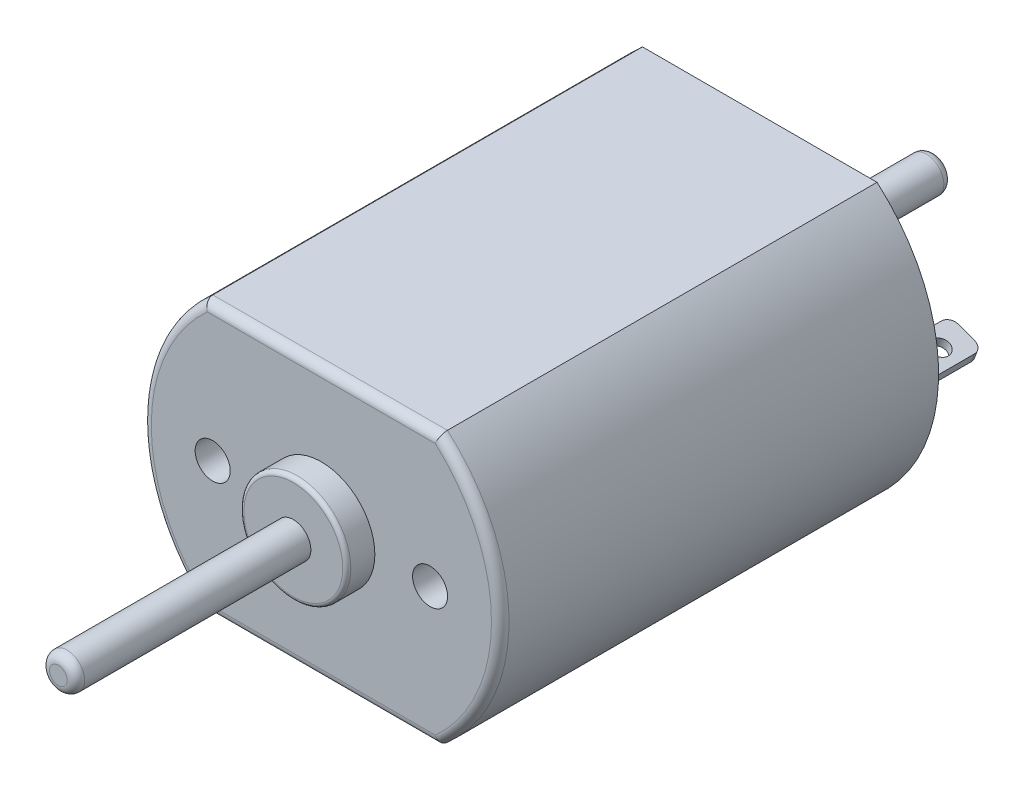
from build123d import *

# Parameters (mm, degrees)
BOSS_EXTRUDE1_DEPTH          = 25
FILLET1_R                    = 0.5
SKETCH2_R                    = 3.05
BOSS_EXTRUDE2_DEPTH          = 1.6
SKETCH3_R                    = 1
BOSS_EXTRUDE3_DEPTH          = 13.4
SKETCH4_R                    = 3.075
BOSS_EXTRUDE4_DEPTH          = 2
FILLET2_R                    = 0.23
BOSS_EXTRUDE6_START          = 8
SKETCH5_R                    = 1
BOSS_EXTRUDE6_DEPTH          = 8
FILLET3_R                    = 0.5
BOSS_EXTRUDE7_DEPTH          = 4.3
SKETCH6_3_R                  = 1.1999999999999995
SKETCH6_3_R_2                = 1.2000000000000004
BOSS_EXTRUDE8_DEPTH          = 0.3
FILLET4_R                    = 0.5
CUT_EXTRUDE1_DEPTH           = 43.18502328832356
CUT_EXTRUDE1_DEPTH_BACK      = 43.18502328832356
SKETCH7_R                    = 0.4999999999999999
SKETCH7_R_2                  = 0.5000000000000017
F_2_0_2_DIAMETER_HOLE1_D     = 2
F_2_0_2_DIAMETER_HOLE1_DEPTH = 2
F_2_0_2_DIAMETER_HOLE1_TIP   = 0.6008606190275603


with BuildPart() as part:
    # Sketch1 → Boss-Extrude1 (new body)
    with BuildSketch(Plane.XY):
        with BuildLine():
            ThreePointArc((-6.689544080129374, 7.700000000000392), (-10.2, 1.25e-15), (-6.689544080129376, -7.70000000000039))
            Line((-6.689544080129249, -7.700000000000001), (6.689544080129178, -7.700000000000001))
            ThreePointArc((6.6895440801293145, -7.700000000000443), (9.280984581856574, -4.2312321126759915), (10.2, -2.5e-15))
            ThreePointArc((10.2, 0), (9.280984581856577, 4.231232112675986), (6.689544080129316, 7.7000000000004425))
            Line((6.689544080129178, 7.699999999999999), (-6.6895440801292505, 7.699999999999999))
        make_face()
    extrude(amount=BOSS_EXTRUDE1_DEPTH)

    # Fillet1
    fillet1_edges = [part.edges().sort_by_distance(p)[0] for p in [
        (-3.553e-14, -7.700000000000001, 25),
        (10.2, 4e-15, 25),
        (-3.642e-14, 7.699999999999999, 25),
        (-10.2, 2.44e-15, 25),
    ]]
    fillet(fillet1_edges, radius=FILLET1_R)

    # Sketch2 → Boss-Extrude2 (add)
    with BuildSketch(Plane.XY.offset(25)):
        Circle(SKETCH2_R)
    extrude(amount=BOSS_EXTRUDE2_DEPTH)

    # Sketch3 → Boss-Extrude3 (add)
    with BuildSketch(Plane.XY.offset(26.6)):
        Circle(SKETCH3_R)
    extrude(amount=BOSS_EXTRUDE3_DEPTH)

    # Sketch4 → Boss-Extrude4 (add)
    with BuildSketch(Plane(origin=(0, 0, 0), x_dir=(-1, 0, 0), z_dir=(0, 0, -1))):
        Circle(SKETCH4_R)
    extrude(amount=BOSS_EXTRUDE4_DEPTH)

    # Fillet2
    fillet2_edges = [part.edges().sort_by_distance(p)[0] for p in [
        (-3.05, 3.7e-16, 26.6),
        (3.075, -9.9e-16, -2),
    ]]
    fillet(fillet2_edges, radius=FILLET2_R)

    # Sketch5 → Boss-Extrude6 (add)
    with BuildSketch(Plane(origin=(0, 0, -2), x_dir=(-1, 0, 0), z_dir=(0, 0, -1)).offset(BOSS_EXTRUDE6_START)):
        with Locations(Location((0, 0, 0), (0, 0, 180))):
            Circle(SKETCH5_R)
    extrude(amount=-BOSS_EXTRUDE6_DEPTH)

    # Fillet3
    fillet3_edges = [part.edges().sort_by_distance(p)[0] for p in [
        (-1, 1.2e-16, 40),
        (-1, -2.4e-16, -10),
    ]]
    fillet(fillet3_edges, radius=FILLET3_R)

    # Sketch6 → Boss-Extrude7 (add)
    with BuildSketch(Plane(origin=(0, 0, 0), x_dir=(-1, 0, 0), z_dir=(0, 0, -1))):
        Polygon((-8.258245331971702, -2.2819029687246677), (-6.382871458127414, -1.5869404997364032), (-6.556612075374479, -1.118097031275331), (-8.431985949218769, -1.8130595002635959), align=None)
        Polygon((6.5566120753744785, 1.118097031275332), (6.382871458127412, 1.5869404997364045), (8.2582453319717, 2.281902968724668), (8.431985949218767, 1.8130595002635954), align=None)
    extrude(amount=BOSS_EXTRUDE7_DEPTH)

    # Sketch6<3> → Boss-Extrude8 (add)
    # profile 1 of 2: a face of its own
    with BuildSketch(Plane(origin=(0, 0, 0), x_dir=(-1, 0, 0), z_dir=(0, 0, -1))):
        with Locations(Location((-7.40742870367309, -1.7, 0), (0, 0, 180))):
            Circle(SKETCH6_3_R)
        Polygon((-6.382871458127414, -1.5869404997364032), (-6.556612075374479, -1.118097031275331), (-8.431985949218769, -1.8130595002635959), (-8.258245331971702, -2.2819029687246677), align=None, mode=Mode.SUBTRACT)
    # profile 2 of 2: a face of its own
    with BuildSketch(Plane(origin=(0, 0, 0), x_dir=(-1, 0, 0), z_dir=(0, 0, -1))):
        with Locations(Location((7.407428703673089, 1.6999999999999995, 0), (0, 0, 180))):
            Circle(SKETCH6_3_R_2)
        Polygon((8.431985949218767, 1.8130595002635954), (6.5566120753744785, 1.118097031275332), (6.382871458127412, 1.5869404997364045), (8.2582453319717, 2.281902968724668), align=None, mode=Mode.SUBTRACT)
    extrude(amount=BOSS_EXTRUDE8_DEPTH)

    # Fillet4
    fillet4_edges = [part.edges().sort_by_distance(p)[0] for p in [
        (8.345115640595235, -2.047481234494132, -4.3),
        (6.469741766750946, -1.352518765505867, -4.3),
        (-6.469741766750945, 1.3525187655058684, -4.3),
        (-8.345115640595234, 2.047481234494132, -4.3),
    ]]
    fillet(fillet4_edges, radius=FILLET4_R)

    # Sketch7 → Cut-Extrude1 (cut, two sides: drawn at the far end of the back side and taken through both)
    with BuildSketch(Plane(origin=(0.2536177540026074, 0.6843939507869876, 0), x_dir=(0.9376869369221446, -0.3474812344941323, 0), z_dir=(-0.3474812344941323, -0.9376869369221446, 0)).offset(-CUT_EXTRUDE1_DEPTH_BACK)):
        with Locations((-7.536567230256415, -2.8000000000000034)):
            Circle(SKETCH7_R)
        with Locations(Location((7.53656723025642, -2.8000000000000034, 0), (0, 0, 180))):
            Circle(SKETCH7_R_2)
    extrude(amount=CUT_EXTRUDE1_DEPTH + CUT_EXTRUDE1_DEPTH_BACK, mode=Mode.SUBTRACT)

    # Ø2.0 (2) Diameter Hole1
    with Locations(Plane.XY.offset(25)):
        with Locations((-6.2, 0), (6.2, 0)):
            Hole(F_2_0_2_DIAMETER_HOLE1_D / 2, depth=F_2_0_2_DIAMETER_HOLE1_DEPTH)
            with Locations((0, 0, -(F_2_0_2_DIAMETER_HOLE1_DEPTH + F_2_0_2_DIAMETER_HOLE1_TIP / 2))):  # 118° drill point
                Cone(0, F_2_0_2_DIAMETER_HOLE1_D / 2, F_2_0_2_DIAMETER_HOLE1_TIP, mode=Mode.SUBTRACT)


solid = part.part
